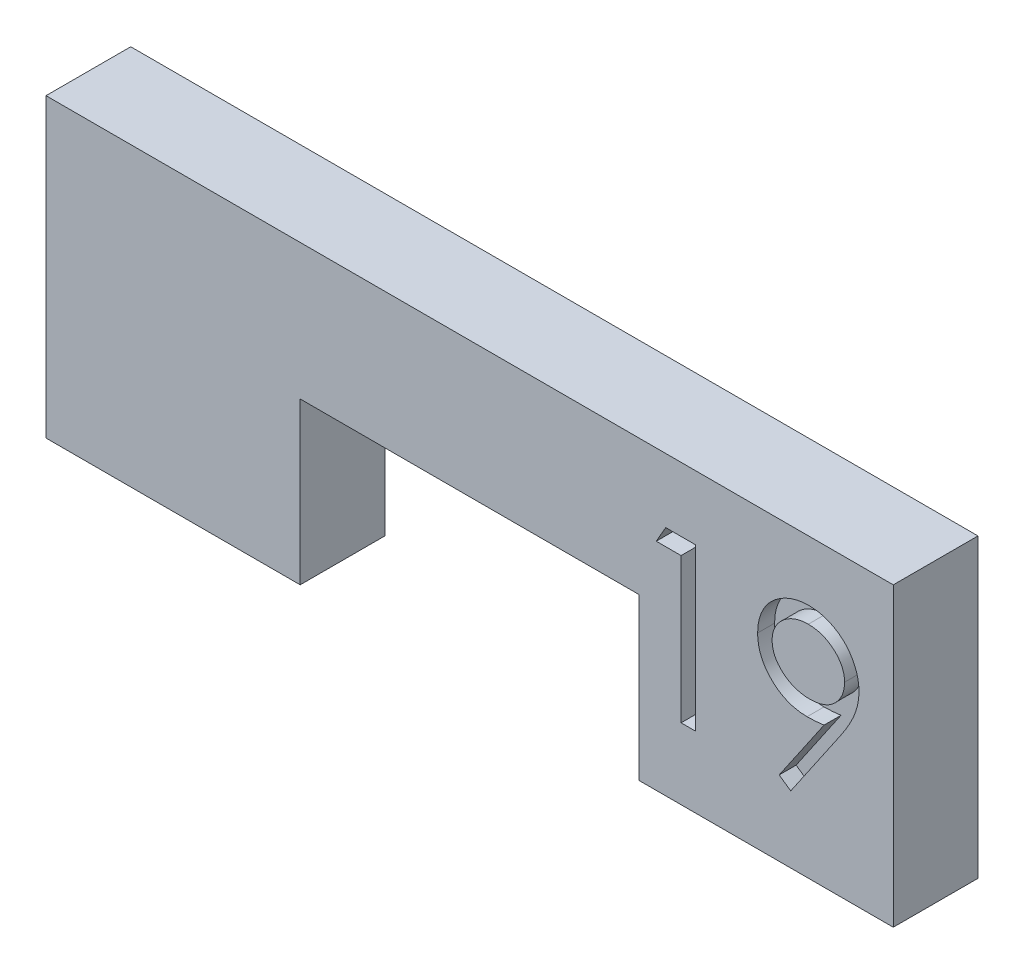
from build123d import *

# Parameters (mm, degrees)
BOSS_EXTRUDE1_DEPTH = 10
CUT_EXTRUDE1_DEPTH  = 2


with BuildPart() as part:
    # Sketch2 → Boss-Extrude1 (new body)
    with BuildSketch(Plane.XY):
        Polygon((50, 35), (-50, 35), (-50, 0), (-20, 0), (-20, 19), (20, 19), (20, 0), (50, 0), align=None)
    extrude(amount=BOSS_EXTRUDE1_DEPTH)

    # Sketch3 → Cut-Extrude1 (cut)
    # profile 1 of 2: a face of its own
    with BuildSketch(Plane.XY.offset(10)):
        Polygon((23.142767448, 27.42405293), (26.665033073, 27.42405293), (26.665033073, 8.37405293), (24.955417689, 8.37405293), (24.955417689, 25.470206776), (22.024648458, 25.470206776), align=None)
    # profile 2 of 2: a face of its own
    with BuildSketch(Plane.XY.offset(10)):
        with BuildLine():
            Line((37.899648458, 7.885591391), (36.533482593, 8.835801728))
            Line((36.533482593, 8.835801728), (41.8302374, 16.578680334))
            add(Edge.make_bspline(
                [(41.8302374, 16.578680334), (41.492286397, 16.537352375), (40.826842028, 16.455975319), (40.156624373, 16.44102567), (39.826781872, 16.433668314)],
                knots=[0, 0, 0, 0, 1.015715272, 2, 2, 2, 2], degree=3))
            add(Edge.make_bspline(
                [(39.826781872, 16.433668314), (39.626800154, 16.438790459), (39.234253531, 16.448844781), (38.657138394, 16.528538052), (38.102589842, 16.651275176), (37.572078062, 16.834420543), (37.063609043, 17.062031081), (36.578292803, 17.344281398), (36.116782656, 17.676329928), (35.684035182, 18.056420925), (35.290452718, 18.47376861), (34.939805911, 18.915487181), (34.648389179, 19.386707821), (34.406309478, 19.877818016), (34.222719438, 20.395876512), (34.089029055, 20.934988247), (34.00672024, 21.498931612), (33.99692802, 21.882789824), (33.99195615, 22.077688747)],
                knots=[0, 0, 0, 0, 1.060718605, 2.082097864, 3.085795603, 4.069760067, 5.054557537, 6.03741023, 7.043284206, 8.066802108, 9.088538119, 10.083643548, 11.053783639, 12.022749082, 12.983451788, 13.964007469, 14.966251758, 16, 16, 16, 16], degree=3))
            add(Edge.make_bspline(
                [(33.99195615, 22.077688747), (34.001396431, 22.344218128), (34.019925787, 22.867361236), (34.169052003, 23.631722179), (34.414308992, 24.354460366), (34.756274871, 25.033675564), (35.186993855, 25.659597274), (35.704656324, 26.223524132), (36.306113615, 26.717435408), (36.977664319, 27.142000458), (37.703485761, 27.483458086), (38.463682314, 27.735131993), (39.252429168, 27.883170892), (39.786741772, 27.902688222), (40.055748218, 27.912514468)],
                knots=[0, 0, 0, 0, 1.022988612, 2.007919123, 2.978103895, 3.94594894, 4.918897164, 5.887013414, 6.875921846, 7.89917871, 8.930658928, 9.948724884, 10.967259574, 12, 12, 12, 12], degree=3))
            add(Edge.make_bspline(
                [(40.055748218, 27.912514468), (40.319663759, 27.902553152), (40.841135992, 27.882870531), (41.607974728, 27.73872207), (42.342439406, 27.495771037), (43.040458548, 27.160030769), (43.686740206, 26.739184114), (44.267905692, 26.237709063), (44.770692555, 25.655293265), (45.19427682, 25.006023055), (45.534292325, 24.308428486), (45.779614323, 23.580261708), (45.930629872, 22.826759525), (45.949659881, 22.316249601), (45.959263843, 22.058608218)],
                knots=[0, 0, 0, 0, 1.026385292, 2.028040595, 3.023318987, 4.028184125, 5.03290303, 6.015178782, 7.004435299, 8.016004309, 9.023023918, 10.015172535, 10.998308025, 12, 12, 12, 12], degree=3))
            add(Edge.make_bspline(
                [(45.959263843, 22.058608218), (45.952849931, 21.858617143), (45.939840916, 21.452985271), (45.848747588, 20.836688691), (45.69406058, 20.208304142), (45.518519191, 19.676419457), (45.34907125, 19.237134894), (45.189589376, 18.890144152), (45.012630369, 18.524921562), (44.806243945, 18.145296765), (44.584380587, 17.746430396), (44.333686525, 17.332323043), (44.059880484, 16.902419009), (43.864864438, 16.612602716), (43.765003025, 16.464197161)],
                knots=[0, 0, 0, 0, 1.179839688, 2.393009684, 3.667231171, 4.993948276, 5.694988576, 6.444077775, 7.246288328, 8.089075292, 8.993003841, 9.939041771, 10.944649915, 12, 12, 12, 12], degree=3))
            Line((43.765003025, 16.464197161), (37.899648458, 7.885591391))
        make_face()
        with BuildLine():
            add(Edge.make_bspline(
                [(40.14351865, 18.387514468), (40.295015213, 18.391653129), (40.589927518, 18.399709693), (41.021966817, 18.44874571), (41.429768552, 18.535689834), (41.814422066, 18.660438552), (42.179784204, 18.81096985), (42.520051647, 19.00262366), (42.835509171, 19.231314202), (43.128269174, 19.488271573), (43.388241801, 19.773752606), (43.61979744, 20.072549715), (43.816614242, 20.385974521), (43.972080079, 20.717952134), (44.099903268, 21.060401512), (44.188175591, 21.418837359), (44.237076034, 21.791392226), (44.245412177, 22.044477779), (44.249648458, 22.173091391)],
                knots=[0, 0, 0, 0, 1.163407946, 2.26475976, 3.333800367, 4.359385343, 5.366239384, 6.363380779, 7.350133999, 8.353570782, 9.349036268, 10.310270964, 11.253520213, 12.184142, 13.120487599, 14.056272588, 15.012232024, 16, 16, 16, 16], degree=3))
            add(Edge.make_bspline(
                [(44.249648458, 22.173091391), (44.246003544, 22.301758712), (44.238820795, 22.55531345), (44.181195635, 22.928419891), (44.079821206, 23.285978925), (43.943801568, 23.629948065), (43.764621417, 23.957501232), (43.549609587, 24.27275082), (43.294162968, 24.573697973), (43.000234715, 24.853264798), (42.683272362, 25.110972649), (42.345485925, 25.338408291), (41.989659596, 25.52902366), (41.617964216, 25.686316625), (41.229625345, 25.809062718), (40.824872781, 25.897331517), (40.401661216, 25.946163495), (40.114380216, 25.95444695), (39.967977785, 25.958668314)],
                knots=[0, 0, 0, 0, 0.972161553, 1.915763587, 2.844109794, 3.775983486, 4.705125789, 5.659731448, 6.655561913, 7.682237399, 8.721216875, 9.739758359, 10.754845918, 11.767244016, 12.7857855, 13.828538656, 14.893392813, 16, 16, 16, 16], degree=3))
            add(Edge.make_bspline(
                [(39.967977785, 25.958668314), (39.822848607, 25.954440131), (39.538106356, 25.946144469), (39.118657146, 25.897424338), (38.716641361, 25.808469088), (38.329427685, 25.686373481), (37.957743349, 25.529011926), (37.601933802, 25.338398303), (37.264068354, 25.111025002), (36.947409888, 24.853062027), (36.652962627, 24.574999267), (36.401907962, 24.271432461), (36.186404063, 23.957665221), (36.007470119, 23.629904483), (35.87138499, 23.285990557), (35.770028095, 22.928416741), (35.712398224, 22.555314271), (35.705216121, 22.301758988), (35.701571535, 22.173091391)],
                knots=[0, 0, 0, 0, 1.099389452, 2.15699305, 3.192601482, 4.213358962, 5.227959689, 6.245255729, 7.266013209, 8.307253147, 9.336162325, 10.327954924, 11.284637477, 12.215801273, 13.149702402, 14.080068371, 15.025723358, 16, 16, 16, 16], degree=3))
            add(Edge.make_bspline(
                [(35.701571535, 22.173091391), (35.704869504, 22.044377624), (35.711373703, 21.790530517), (35.774117816, 21.41755115), (35.879046739, 21.060019694), (36.019577993, 20.714459731), (36.204643791, 20.384231475), (36.431740735, 20.070900548), (36.697926636, 19.770915026), (36.99964319, 19.488935773), (37.329851323, 19.230116075), (37.682530756, 19.004072138), (38.051610011, 18.813177834), (38.438388315, 18.660008301), (38.839999326, 18.536936247), (39.260052541, 18.44890595), (39.697158805, 18.400180041), (39.993304563, 18.391776831), (40.14351865, 18.387514468)],
                knots=[0, 0, 0, 0, 0.952633368, 1.87876736, 2.791047057, 3.707742249, 4.635551637, 5.587206343, 6.568248508, 7.601284464, 8.641511608, 9.671105535, 10.699146789, 11.713763218, 12.747829548, 13.806491675, 14.887386225, 16, 16, 16, 16], degree=3))
        make_face(mode=Mode.SUBTRACT)
    extrude(amount=-CUT_EXTRUDE1_DEPTH, mode=Mode.SUBTRACT)


solid = part.part
